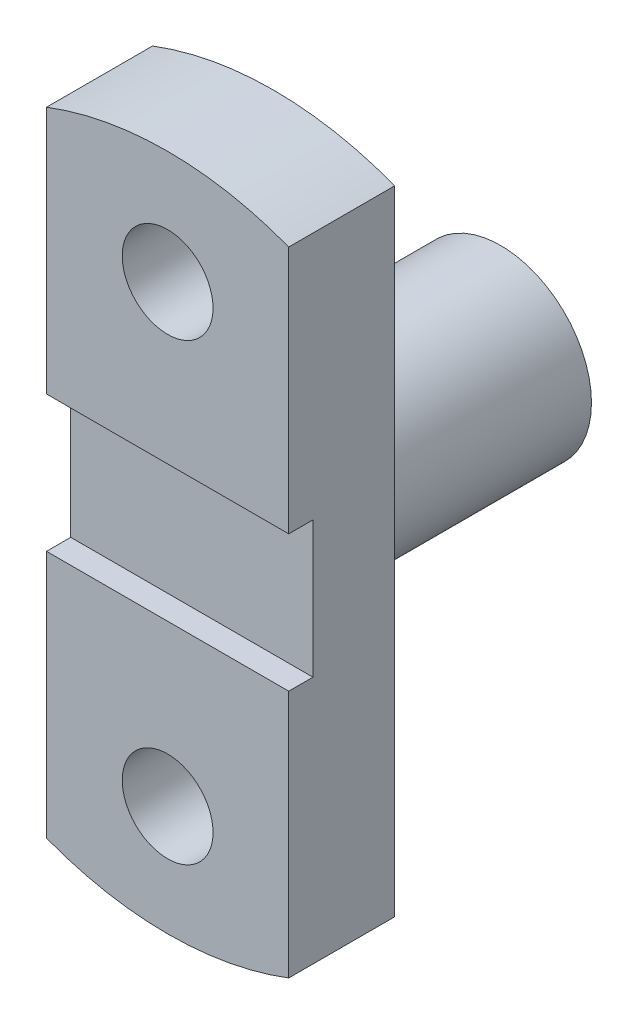
from build123d import *

# Parameters (mm, degrees)
BOSS_EXTRUDE1_DEPTH     = 35
CUT_EXTRUDE1_DEPTH      = 124.917223134
CUT_EXTRUDE1_DEPTH_BACK = 124.917223134
SKETCH2_W               = 8
SKETCH2_H               = 45
CUT_EXTRUDE2_DEPTH      = 124.917223134
CUT_EXTRUDE2_DEPTH_BACK = 124.917223134
SKETCH3_R               = 15
CUT_EXTRUDE3_DEPTH      = 124.917223134
CUT_EXTRUDE3_DEPTH_BACK = 124.917223134
SKETCH4_R               = 15
SKETCH5_R               = 30
BOSS_EXTRUDE2_DEPTH     = 75


with BuildPart() as part:
    # Sketch1 → Boss-Extrude1 (new body)
    with BuildSketch(Plane.XY):
        with BuildLine():
            Line((-40, -104.548927251), (-40, 104.548927251))
            ThreePointArc((-40, 104.548927251), (0, 111.939618497), (40, 104.548927251))
            Line((40, 104.548927251), (40, -104.548927251))
            ThreePointArc((40, -104.548927251), (0, -111.939618497), (-40, -104.548927251))
        make_face()
    extrude(amount=BOSS_EXTRUDE1_DEPTH)

    # Sketch2 → Cut-Extrude1 (cut, two sides: drawn at the far end of the back side and taken through both)
    with BuildSketch(Plane(origin=(0, 0, 0), x_dir=(0, 0, -1), z_dir=(1, 0, 0)).offset(-CUT_EXTRUDE1_DEPTH_BACK)):
        with Locations((-31, 0)):
            Rectangle(SKETCH2_W, SKETCH2_H)
    extrude(amount=CUT_EXTRUDE1_DEPTH + CUT_EXTRUDE1_DEPTH_BACK, mode=Mode.SUBTRACT)

    # Sketch3 → Cut-Extrude2 (cut, two sides: drawn at the far end of the back side and taken through both)
    with BuildSketch(Plane.XY.offset(-CUT_EXTRUDE2_DEPTH_BACK)):
        with Locations((0, 74.548927251)):
            Circle(SKETCH3_R)
    extrude(amount=CUT_EXTRUDE2_DEPTH + CUT_EXTRUDE2_DEPTH_BACK, mode=Mode.SUBTRACT)

    # Sketch4 → Cut-Extrude3 (cut, two sides: drawn at the far end of the back side and taken through both)
    with BuildSketch(Plane.XY.offset(-CUT_EXTRUDE3_DEPTH_BACK)):
        with Locations((0, -75.451072749)):
            Circle(SKETCH4_R)
    extrude(amount=CUT_EXTRUDE3_DEPTH + CUT_EXTRUDE3_DEPTH_BACK, mode=Mode.SUBTRACT)

    # Sketch5 → Boss-Extrude2 (add)
    with BuildSketch(Plane(origin=(0, 0, 0), x_dir=(-1, 0, 0), z_dir=(0, 0, -1))):
        with Locations(Location((0, 0, 0), (0, 0, 180))):
            Circle(SKETCH5_R)
    extrude(amount=BOSS_EXTRUDE2_DEPTH)


solid = part.part
